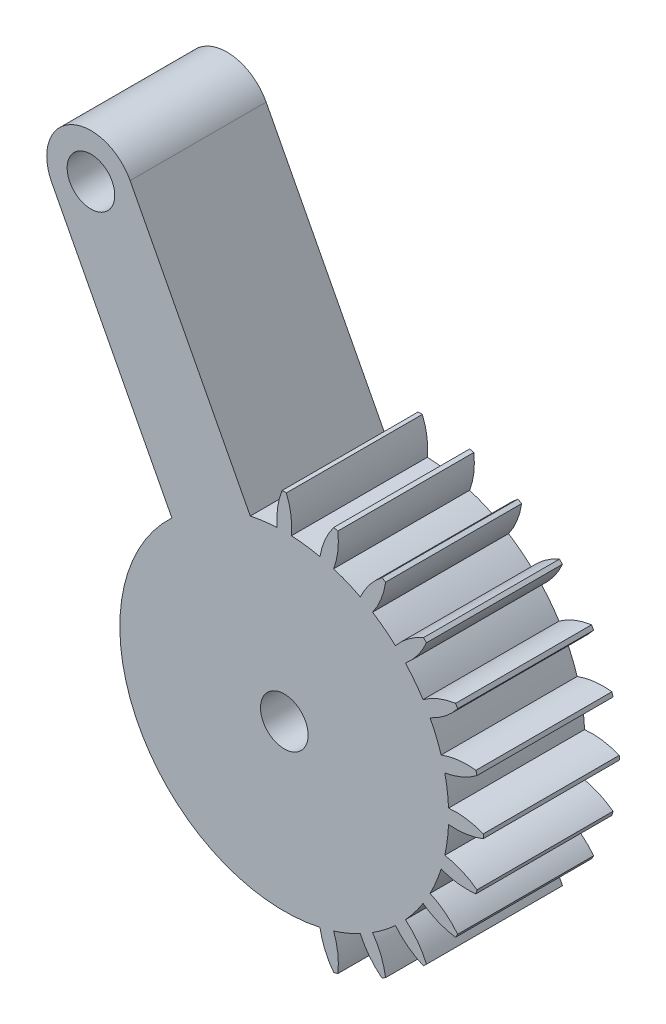
from build123d import *

# Parameters (mm, degrees)
SKETCH1_R           = 1.75
BOSS_EXTRUDE1_DEPTH = 10


with BuildPart() as part:
    # Sketch1 → Boss-Extrude1 (new body)
    with BuildSketch(Plane.XY):
        with BuildLine():
            Line((0.155, 14.63), (-0.155, 14.63))
            ThreePointArc((-0.155, 14.63), (-0.491925829, 13.37649981), (-0.52, 12.078812028))
            ThreePointArc((-0.52, 12.078812028), (-1.515917744, 11.994586003), (-2.50147536, 11.828386239))
            Line((-2.50147536, 11.828386239), (-11.333513235, 28.769367003))
            ThreePointArc((-11.333513235, 28.769367003), (-15.717822608, 30.148798524), (-17.097254129, 25.764489151))
            Line((-17.097254129, 25.764489151), (-8.265216255, 8.823508388))
            ThreePointArc((-8.265216255, 8.823508388), (-10.691447625, -5.644559122), (2.623945165, -11.801822392))
            ThreePointArc((2.623945165, -11.801822392), (2.986929045, -13.048026405), (3.636804127, -14.171611791))
            Line((3.636804127, -14.171611791), (3.936241133, -14.091377887))
            ThreePointArc((3.936241133, -14.091377887), (3.937256771, -12.793386859), (3.628508025, -11.532650585))
            ThreePointArc((3.628508025, -11.532650585), (4.626642697, -11.169703548), (5.589072804, -10.720558064))
            ThreePointArc((5.589072804, -10.720558064), (6.26222964, -11.830351564), (7.180766062, -12.747451657))
            Line((7.180766062, -12.747451657), (7.449233938, -12.592451657))
            ThreePointArc((7.449233938, -12.592451657), (7.11427017, -11.338425735), (6.489739224, -10.200558064))
            ThreePointArc((6.489739224, -10.200558064), (7.359925677, -9.591641884), (8.173314367, -8.90870542))
            ThreePointArc((8.173314367, -8.90870542), (9.110769635, -9.806457814), (10.235370658, -10.45457376))
            Line((10.235370658, -10.45457376), (10.45457376, -10.235370658))
            ThreePointArc((10.45457376, -10.235370658), (9.806457814, -9.110769635), (8.90870542, -8.173314367))
            ThreePointArc((8.90870542, -8.173314367), (9.591641884, -7.359925677), (10.200558064, -6.489739224))
            ThreePointArc((10.200558064, -6.489739224), (11.338425735, -7.11427017), (12.592451657, -7.449233938))
            Line((12.592451657, -7.449233938), (12.747451657, -7.180766062))
            ThreePointArc((12.747451657, -7.180766062), (11.830351564, -6.26222964), (10.720558064, -5.589072804))
            ThreePointArc((10.720558064, -5.589072804), (11.169703548, -4.626642697), (11.532650585, -3.628508025))
            ThreePointArc((11.532650585, -3.628508025), (12.793386859, -3.937256771), (14.091377887, -3.936241133))
            Line((14.091377887, -3.936241133), (14.171611791, -3.636804127))
            ThreePointArc((14.171611791, -3.636804127), (13.048026405, -2.986929045), (11.801822392, -2.623945165))
            ThreePointArc((11.801822392, -2.623945165), (11.986568374, -1.578061664), (12.078812028, -0.52))
            ThreePointArc((12.078812028, -0.52), (13.37649981, -0.491925829), (14.63, -0.155))
            Line((14.63, -0.155), (14.63, 0.155))
            ThreePointArc((14.63, 0.155), (13.37649981, 0.491925829), (12.078812028, 0.52))
            ThreePointArc((12.078812028, 0.52), (11.986568374, 1.578061664), (11.801822392, 2.623945165))
            ThreePointArc((11.801822392, 2.623945165), (13.048026405, 2.986929045), (14.171611791, 3.636804127))
            Line((14.171611791, 3.636804127), (14.091377887, 3.936241133))
            ThreePointArc((14.091377887, 3.936241133), (12.793386859, 3.937256771), (11.532650585, 3.628508025))
            ThreePointArc((11.532650585, 3.628508025), (11.169703548, 4.626642697), (10.720558064, 5.589072804))
            ThreePointArc((10.720558064, 5.589072804), (11.830351564, 6.26222964), (12.747451657, 7.180766062))
            Line((12.747451657, 7.180766062), (12.592451657, 7.449233938))
            ThreePointArc((12.592451657, 7.449233938), (11.338425735, 7.11427017), (10.200558064, 6.489739224))
            ThreePointArc((10.200558064, 6.489739224), (9.591641884, 7.359925677), (8.90870542, 8.173314367))
            ThreePointArc((8.90870542, 8.173314367), (9.806457814, 9.110769635), (10.45457376, 10.235370658))
            Line((10.45457376, 10.235370658), (10.235370658, 10.45457376))
            ThreePointArc((10.235370658, 10.45457376), (9.110769635, 9.806457814), (8.173314367, 8.90870542))
            ThreePointArc((8.173314367, 8.90870542), (7.359925677, 9.591641884), (6.489739224, 10.200558064))
            ThreePointArc((6.489739224, 10.200558064), (7.11427017, 11.338425735), (7.449233938, 12.592451657))
            Line((7.449233938, 12.592451657), (7.180766062, 12.747451657))
            ThreePointArc((7.180766062, 12.747451657), (6.26222964, 11.830351564), (5.589072804, 10.720558064))
            ThreePointArc((5.589072804, 10.720558064), (4.626642697, 11.169703548), (3.628508025, 11.532650585))
            ThreePointArc((3.628508025, 11.532650585), (3.937256771, 12.793386859), (3.936241133, 14.091377887))
            Line((3.936241133, 14.091377887), (3.636804127, 14.171611791))
            ThreePointArc((3.636804127, 14.171611791), (2.986929045, 13.048026405), (2.623945165, 11.801822392))
            ThreePointArc((2.623945165, 11.801822392), (1.578061664, 11.986568374), (0.52, 12.078812028))
            ThreePointArc((0.52, 12.078812028), (0.491925829, 13.37649981), (0.155, 14.63))
        make_face()
        Circle(SKETCH1_R, mode=Mode.SUBTRACT)
        with Locations((-14.215383682, 27.266928077)):
            Circle(SKETCH1_R, mode=Mode.SUBTRACT)
    extrude(amount=BOSS_EXTRUDE1_DEPTH)


solid = part.part
